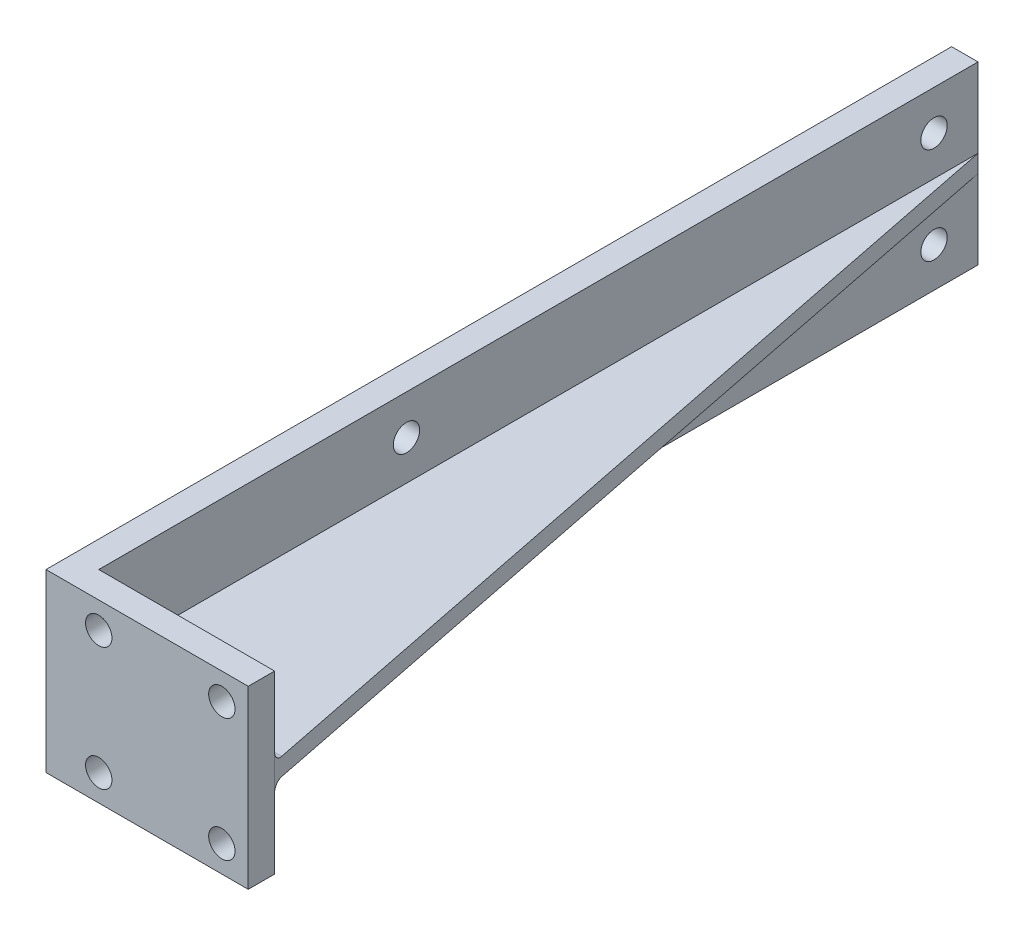
from build123d import *

# Parameters (mm, degrees)
EXTRUDE_1_DEPTH      = 2
EXTRUDE_2_DEPTH      = 10
EXTRUDE_2_DEPTH_BACK = 10
SKETCH_3_R           = 1.5
CUT_EXTRUDE_1_DEPTH  = 103.571925984
SKETCH_4_R           = 1.5
CUT_EXTRUDE_2_DEPTH  = 103.571925984
FILLET_1_R           = 1


with BuildPart() as part:
    # 草图1 → 凸台-拉伸1 (new body)
    with BuildSketch(Plane(origin=(0, 0, 0), x_dir=(1, 0, 0), z_dir=(0, 1, 0))):
        Polygon((0, 100), (0, 0), (20, 0), align=None)
    extrude(amount=EXTRUDE_1_DEPTH)

    # 草图2 → 凸台-拉伸2 (add, two sides: drawn at the far end of the back side and taken through both)
    with BuildSketch(Plane(origin=(0, 1, 0), x_dir=(-1, 0, 0), z_dir=(0, -1, 0)).offset(-EXTRUDE_2_DEPTH_BACK)):
        Polygon((-20, 0), (-20, -3), (3, -3), (3, 100), (0, 100), (0, 0), align=None)
    extrude(amount=EXTRUDE_2_DEPTH + EXTRUDE_2_DEPTH_BACK)

    # 草图3 → 切除-拉伸1 (cut, through all)
    with BuildSketch(Plane(origin=(0, 0, 0), x_dir=(0, 0, -1), z_dir=(1, 0, 0))):
        with Locations((95, 6.5)):
            Circle(SKETCH_3_R)
        with Locations((35, 6.5)):
            Circle(SKETCH_3_R)
        with Locations(Location((95, -4.5, 0), (0, 0, 180))):
            Circle(SKETCH_3_R)
        with Locations(Location((35, -4.5, 0), (0, 0, 180))):
            Circle(SKETCH_3_R)
    extrude(amount=-CUT_EXTRUDE_1_DEPTH, mode=Mode.SUBTRACT)

    # 草图4 → 切除-拉伸2 (cut, through all)
    with BuildSketch(Plane(origin=(0, 0, 0), x_dir=(-1, 0, 0), z_dir=(0, 0, -1))):
        with Locations((-17, 8)):
            Circle(SKETCH_4_R)
        with Locations(Location((-17, -6, 0), (0, 0, 180))):
            Circle(SKETCH_4_R)
        with Locations((-3, -6)):
            Circle(SKETCH_4_R)
        with Locations(Location((-3, 8, 0), (0, 0, 180))):
            Circle(SKETCH_4_R)
    extrude(amount=-CUT_EXTRUDE_2_DEPTH, mode=Mode.SUBTRACT)

    # 圆角1
    fillet_1_edges = [part.edges().sort_by_distance(p)[0] for p in [
        (10, 2, 0),
        (10, 0, 0),
    ]]
    fillet(fillet_1_edges, radius=FILLET_1_R)


solid = part.part
